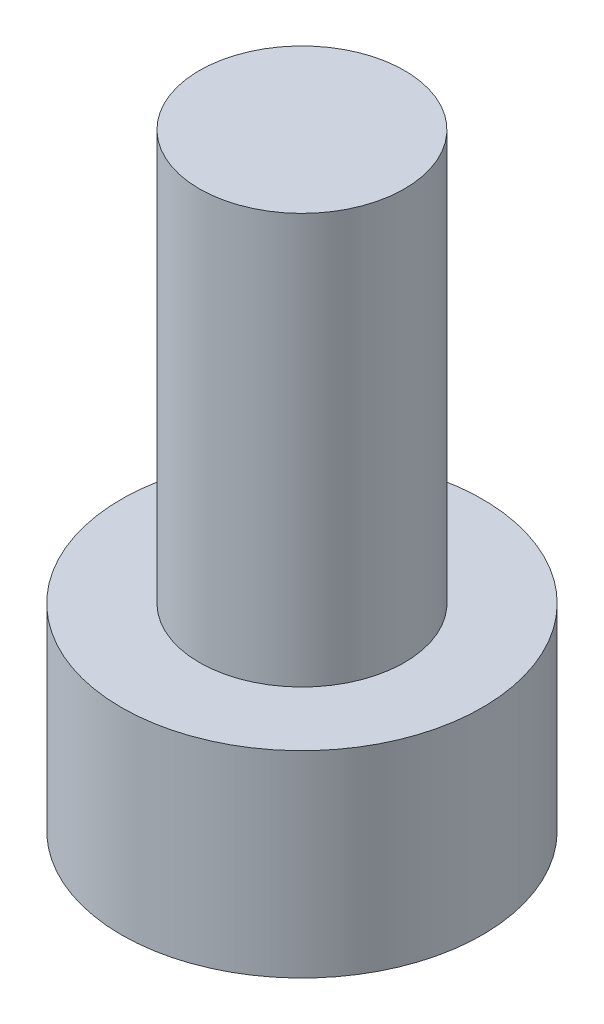
from build123d import *

# Parameters (mm, degrees)
SKETCH_1_R          = 2.2
EXTRUDE_1_DEPTH     = 2.4
SKETCH_2_R          = 1.25
EXTRUDE_2_DEPTH     = 5
CUT_EXTRUDE_1_DEPTH = 1


with BuildPart() as part:
    # 草图1 → 凸台-拉伸1 (new body)
    with BuildSketch(Plane(origin=(0, 0, 0), x_dir=(1, 0, 0), z_dir=(0, 1, 0))):
        with Locations(Location((0, 0, 0), (0, 0, 270))):
            Circle(SKETCH_1_R)
    extrude(amount=EXTRUDE_1_DEPTH)

    # 草图2 → 凸台-拉伸2 (add)
    with BuildSketch(Plane(origin=(0, 2.4, 0), x_dir=(1, 0, 0), z_dir=(0, 1, 0))):
        with Locations(Location((0, 0, 0), (0, 0, 270))):
            Circle(SKETCH_2_R)
    extrude(amount=EXTRUDE_2_DEPTH)

    # 草图3 → 切除-拉伸1 (cut)
    with BuildSketch(Plane.XZ):
        Polygon((0.576435609, 1.000527522), (-0.578264446, 0.999471642), (-1.154700056, -0.00105588), (-0.576435609, -1.000527522), (0.578264446, -0.999471642), (1.154700056, 0.00105588), align=None)
    extrude(amount=-CUT_EXTRUDE_1_DEPTH, mode=Mode.SUBTRACT)


solid = part.part
